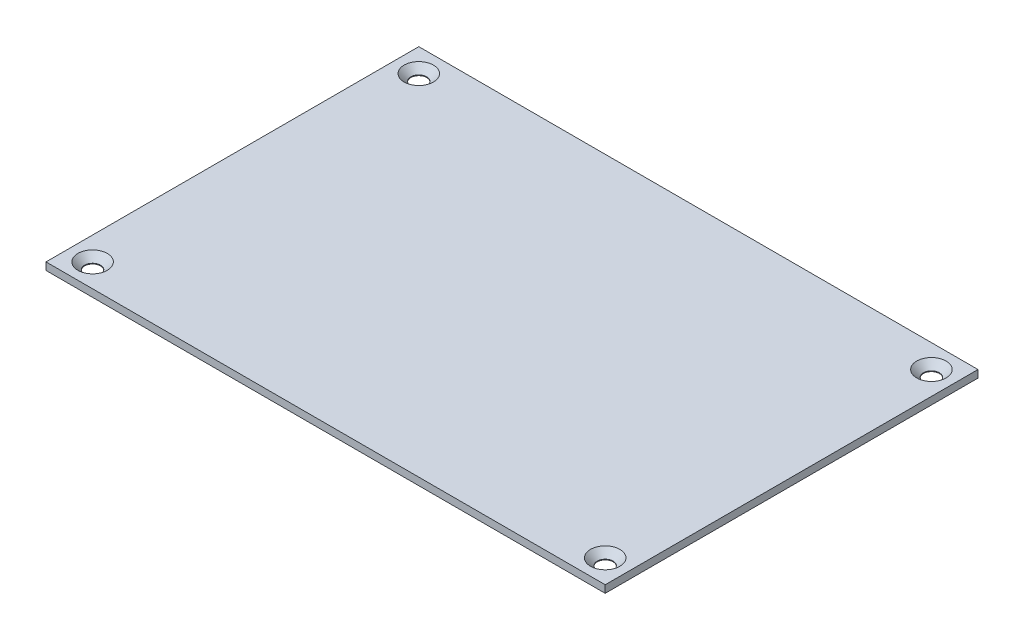
from build123d import *

# Parameters (mm, degrees)
SKETCH1_W                                           = 120
SKETCH1_H                                           = 80
BOSS_EXTRUDE1_DEPTH                                 = 1.6
CSK_FOR_M3_COUNTERSUNK_FLAT_HEAD_SCREW1_D           = 3.4
CSK_FOR_M3_COUNTERSUNK_FLAT_HEAD_SCREW1_DEPTH       = 30
CSK_FOR_M3_COUNTERSUNK_FLAT_HEAD_SCREW1_CSINK_D     = 6.3
CSK_FOR_M3_COUNTERSUNK_FLAT_HEAD_SCREW1_CSINK_ANGLE = 90
CSK_FOR_M3_COUNTERSUNK_FLAT_HEAD_SCREW1_TIP         = 1.021463052


with BuildPart() as part:
    # Sketch1 → Boss-Extrude1 (new body)
    with BuildSketch(Plane(origin=(0, 0, 0), x_dir=(1, 0, 0), z_dir=(0, 1, 0))):
        with Locations((60, 40)):
            Rectangle(SKETCH1_W, SKETCH1_H)
    extrude(amount=BOSS_EXTRUDE1_DEPTH)

    # CSK for M3 Countersunk Flat Head Screw1
    with Locations(Plane(origin=(0, 1.6, 0), x_dir=(1, 0, 0), z_dir=(0, 1, 0))):
        with Locations((5, 75), (5, 5), (115, 5), (115, 75)):
            CounterSinkHole(CSK_FOR_M3_COUNTERSUNK_FLAT_HEAD_SCREW1_D / 2, CSK_FOR_M3_COUNTERSUNK_FLAT_HEAD_SCREW1_CSINK_D / 2, depth=CSK_FOR_M3_COUNTERSUNK_FLAT_HEAD_SCREW1_DEPTH, counter_sink_angle=CSK_FOR_M3_COUNTERSUNK_FLAT_HEAD_SCREW1_CSINK_ANGLE)
            with Locations((0, 0, -(CSK_FOR_M3_COUNTERSUNK_FLAT_HEAD_SCREW1_DEPTH + CSK_FOR_M3_COUNTERSUNK_FLAT_HEAD_SCREW1_TIP / 2))):  # 118° drill point
                Cone(0, CSK_FOR_M3_COUNTERSUNK_FLAT_HEAD_SCREW1_D / 2, CSK_FOR_M3_COUNTERSUNK_FLAT_HEAD_SCREW1_TIP, mode=Mode.SUBTRACT)


solid = part.part
